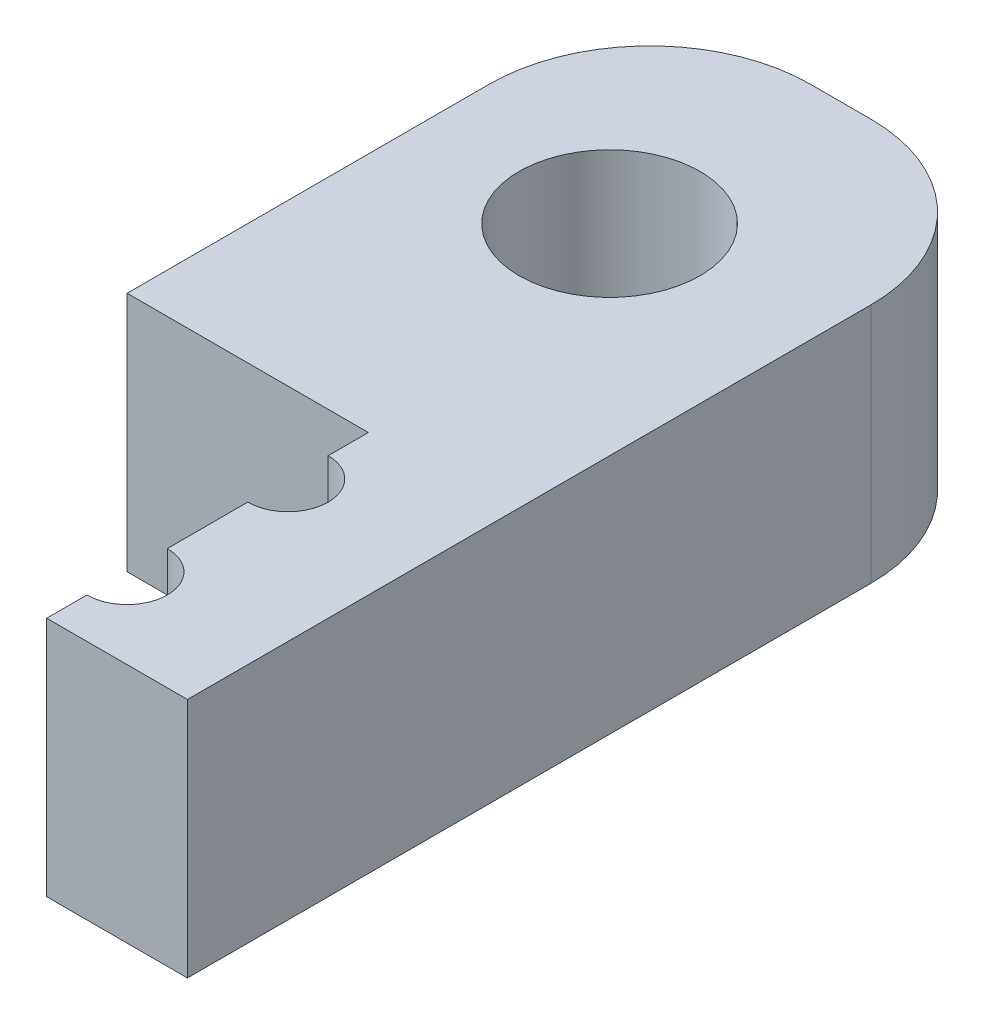
from build123d import *

# Parameters (mm, degrees)
BOSS_EXTRUDE1_DEPTH = 6
SKETCH2_R           = 1
SKETCH2_R_2         = 2.25
CUT_EXTRUDE1_DEPTH  = 18.182840277
FILLET1_R           = 4


with BuildPart() as part:
    # Sketch1 → Boss-Extrude1 (new body)
    with BuildSketch(Plane(origin=(0, 0, 0), x_dir=(1, 0, 0), z_dir=(0, 1, 0))):
        Polygon((0, 13), (9.5, 13), (9.5, -8), (6, -8), (6, 0), (0, 0), align=None)
    extrude(amount=BOSS_EXTRUDE1_DEPTH)

    # Sketch2 → Cut-Extrude1 (cut, through all)
    with BuildSketch(Plane(origin=(0, 6, 0), x_dir=(1, 0, 0), z_dir=(0, 1, 0))):
        with Locations((6, -2)):
            Circle(SKETCH2_R)
        with Locations(Location((4.5, 7.5, 0), (0, 0, 270))):
            Circle(SKETCH2_R_2)
        with Locations((6, -6)):
            Circle(SKETCH2_R)
    extrude(amount=-CUT_EXTRUDE1_DEPTH, mode=Mode.SUBTRACT)

    # Fillet1
    fillet1_edges = [part.edges().sort_by_distance(p)[0] for p in [
        (0, 3, -13),
        (9.5, 3, -13),
    ]]
    fillet(fillet1_edges, radius=FILLET1_R)


solid = part.part
